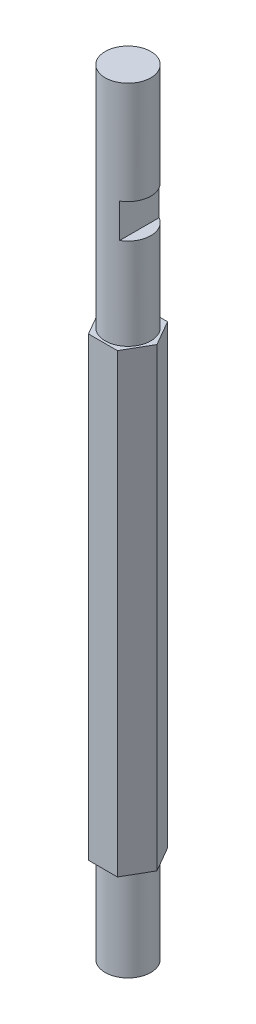
from build123d import *

# Parameters (mm, degrees)
BOSS_EXTRUDE1_DEPTH                 = 200
SKETCH4_R                           = 10
BOSS_EXTRUDE4_DEPTH                 = 40
BOSS_EXTRUDE5_START                 = 100
SKETCH5_R                           = 10
BOSS_EXTRUDE5_DEPTH                 = 100
CUT_EXTRUDE1_REACH                  = 302.47
CUT_EXTRUDE1_END_RADIUS             = 10
SKETCH6_W                           = 5
SKETCH6_H                           = 15
CUT_EXTRUDE1_DIRECTION_2_REACH      = 302.47
CUT_EXTRUDE1_DIRECTION_2_END_RADIUS = 10


with BuildPart() as part:
    # Sketch1 → Boss-Extrude1 (new body)
    with BuildSketch(Plane(origin=(0, 0, 0), x_dir=(1, 0, 0), z_dir=(0, 1, 0))):
        Polygon((12.701705922, 0), (6.350852961, 11), (-6.350852961, 11), (-12.701705922, 0), (-6.350852961, -11), (6.350852961, -11), align=None)
    extrude(amount=BOSS_EXTRUDE1_DEPTH)

    # Sketch4 → Boss-Extrude4 (add)
    with BuildSketch(Plane.XZ):
        with Locations(Location((0, 0, 0), (0, 0, 90))):
            Circle(SKETCH4_R)
    extrude(amount=BOSS_EXTRUDE4_DEPTH)

    # Sketch5 → Boss-Extrude5 (add)
    with BuildSketch(Plane(origin=(0, 200, 0), x_dir=(1, 0, 0), z_dir=(0, 1, 0)).offset(BOSS_EXTRUDE5_START)):
        with Locations(Location((0, 0, 0), (0, 0, 270))):
            Circle(SKETCH5_R)
    extrude(amount=-BOSS_EXTRUDE5_DEPTH)

    # Cut-Extrude1: up to this cylinder (the profile starts inside it)
    cut_extrude1_end = Plane(origin=(0, 247.5, 0), z_dir=(0, -1, 0)) * Cylinder(CUT_EXTRUDE1_END_RADIUS, 625.94, mode=Mode.PRIVATE)
    # Sketch6 → Cut-Extrude1 (cut, up to the surface)
    with BuildSketch(Plane.XY, mode=Mode.PRIVATE) as cut_extrude1_sk1:
        with Locations((7.5, 247.5)):
            Rectangle(SKETCH6_W, SKETCH6_H)
    cut_extrude1_tool1 = extrude(cut_extrude1_sk1.sketch, amount=-CUT_EXTRUDE1_REACH, mode=Mode.PRIVATE) & cut_extrude1_end
    add(cut_extrude1_tool1.solids().sort_by_distance((7.5, 247.5, 0))[0], mode=Mode.SUBTRACT)

    # Cut-Extrude1 direction 2: up to this cylinder (the profile starts inside it)
    cut_extrude1_direction_2_end = Plane(origin=(0, 247.5, 0), z_dir=(0, -1, 0)) * Cylinder(CUT_EXTRUDE1_DIRECTION_2_END_RADIUS, 625.94, mode=Mode.PRIVATE)
    # Sketch6 → Cut-Extrude1 direction 2 (cut, up to the surface)
    with BuildSketch(Plane.XY, mode=Mode.PRIVATE) as cut_extrude1_direction_2_sk1:
        with Locations((7.5, 247.5)):
            Rectangle(SKETCH6_W, SKETCH6_H)
    cut_extrude1_direction_2_tool1 = extrude(cut_extrude1_direction_2_sk1.sketch, amount=CUT_EXTRUDE1_DIRECTION_2_REACH, mode=Mode.PRIVATE) & cut_extrude1_direction_2_end
    add(cut_extrude1_direction_2_tool1.solids().sort_by_distance((7.5, 247.5, 0))[0], mode=Mode.SUBTRACT)


solid = part.part
